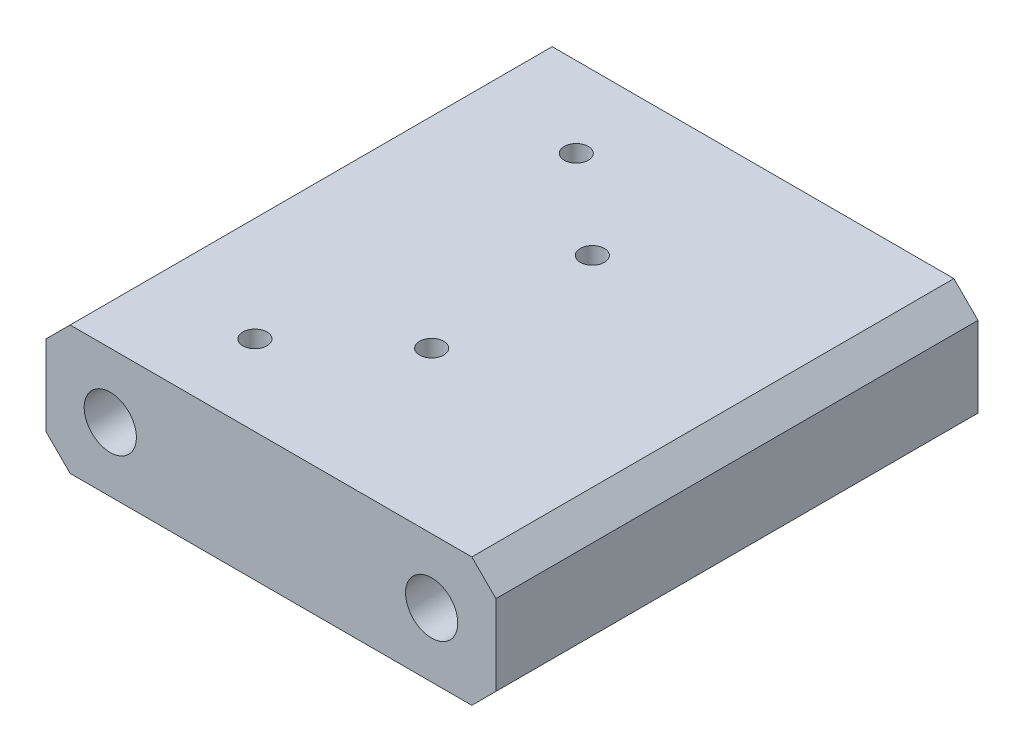
from build123d import *

# Parameters (mm, degrees)
SKETCH_1_W          = 50
SKETCH_1_H          = 60
EXTRUDE_1_DEPTH     = 16
SKETCH_2_R          = 3.25
CUT_EXTRUDE_1_DEPTH = 100
SKETCH_3_R          = 1.5
CUT_EXTRUDE_2_DEPTH = 100
EXTRUDE_2_DEPTH     = 60
SKETCH_5_R          = 1.5
CUT_EXTRUDE_3_DEPTH = 60


with BuildPart() as part:
    # 草圖1 → 填料-伸長1 (new body)
    with BuildSketch(Plane(origin=(0, 0, 0), x_dir=(1, 0, 0), z_dir=(0, 1, 0))):
        with Locations((25, 30)):
            Rectangle(SKETCH_1_W, SKETCH_1_H)
    extrude(amount=EXTRUDE_1_DEPTH)

    # 草圖2 → 除料-伸長1 (cut)
    with BuildSketch(Plane(origin=(0, 0, -60), x_dir=(-1, 0, 0), z_dir=(0, 0, -1))):
        with Locations((-45, 8)):
            Circle(SKETCH_2_R)
        with Locations((-5, 8)):
            Circle(SKETCH_2_R)
    extrude(amount=-CUT_EXTRUDE_1_DEPTH, mode=Mode.SUBTRACT)

    # 草圖3 → 除料-伸長2 (cut)
    with BuildSketch(Plane(origin=(0, 16, 0), x_dir=(1, 0, 0), z_dir=(0, 1, 0))):
        with Locations(Location((13, 10, 0), (0, 0, 270))):
            Circle(SKETCH_3_R)
        with Locations(Location((13, 50, 0), (0, 0, 270))):
            Circle(SKETCH_3_R)
    extrude(amount=-CUT_EXTRUDE_2_DEPTH, mode=Mode.SUBTRACT)

    # 草圖4 → 填料-伸長2 (add)
    with BuildSketch(Plane.XY):
        Polygon((0, 0), (-3, 3), (-3, 13), (0, 16), align=None)
        Polygon((53, 13), (50, 16), (50, 0), (53, 3), align=None)
    extrude(amount=-EXTRUDE_2_DEPTH)

    # 草圖5 → 除料-伸長3 (cut)
    with BuildSketch(Plane(origin=(0, 16, 0), x_dir=(1, 0, 0), z_dir=(0, 1, 0))):
        with Locations(Location((25, 20, 0), (0, 0, 270))):
            Circle(SKETCH_5_R)
        with Locations(Location((25, 40, 0), (0, 0, 270))):
            Circle(SKETCH_5_R)
    extrude(amount=-CUT_EXTRUDE_3_DEPTH, mode=Mode.SUBTRACT)


solid = part.part
